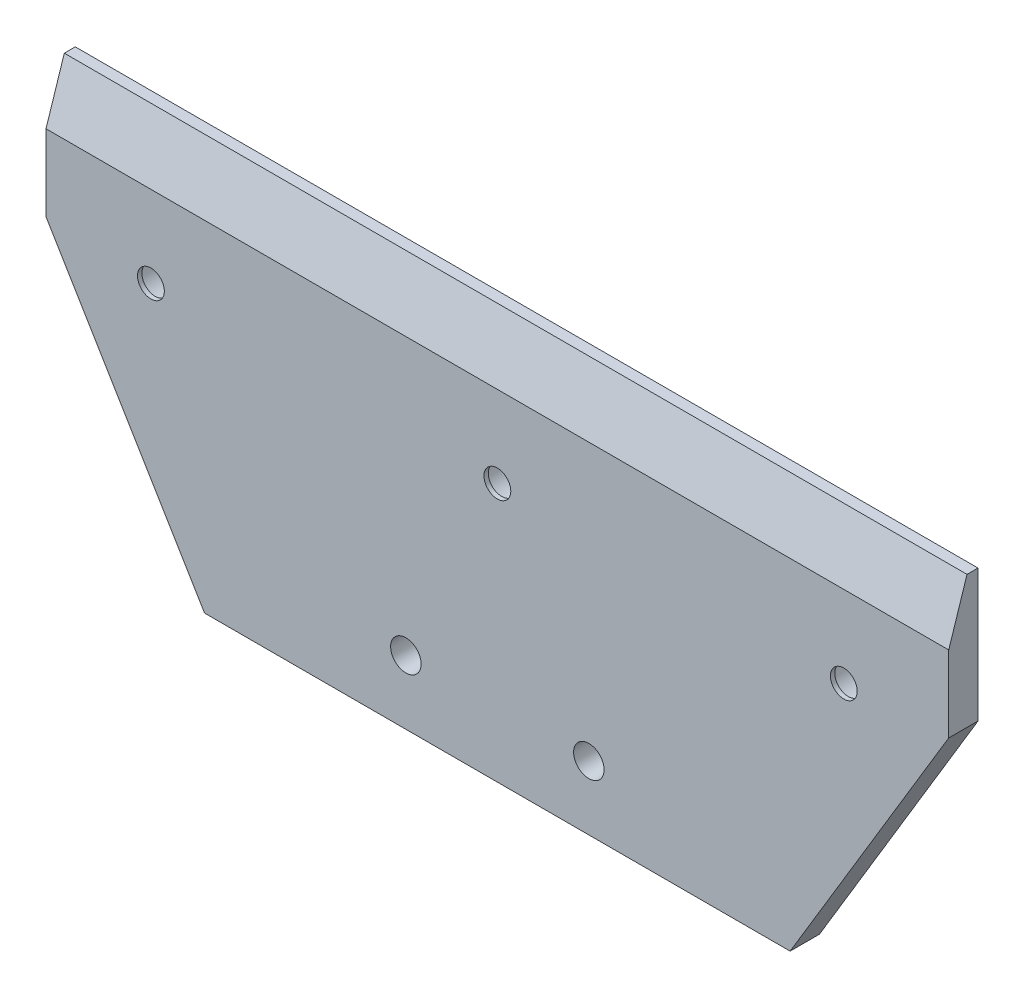
from build123d import *

# Parameters (mm, degrees)
BOSS_EXTRUDE1_DEPTH            = 1.2
CUT_EXTRUDE1_DEPTH             = 81.831243959
F_2_5_2_5_DIAMETER_HOLE1_D     = 2.5
F_2_5_2_5_DIAMETER_HOLE1_DEPTH = 10
F_2_5_2_5_DIAMETER_HOLE1_TIP   = 0.751075774
HOLEWZD1_AT_2_COUNT            = 2
HOLEWZD1_AT_2_PITCH            = 28.4
HOLEWZD1_AT_3_COUNT            = 2
HOLEWZD1_AT_3_PITCH            = 56.8


with BuildPart() as part:
    # Sketch1 → Boss-Extrude1 (new, symmetric)
    with BuildSketch(Plane.XY):
        Polygon((-24, 0), (24, 0), (37, 21.635633271), (37, 32.5), (-37, 32.5), (-37, 21.635633271), align=None)
    extrude(amount=BOSS_EXTRUDE1_DEPTH, both=True)

    # Sketch2 → Cut-Extrude1 (cut, through all)
    with BuildSketch(Plane(origin=(37, 0, 0), x_dir=(0, 0, -1), z_dir=(1, 0, 0))):
        Polygon((-1.2, 27.883474694), (0.3, 32.5), (-1.2, 32.5), align=None)
    extrude(amount=-CUT_EXTRUDE1_DEPTH, mode=Mode.SUBTRACT)

    # Ø2.5 (2.5) Diameter Hole1
    with Locations(Plane.XY.offset(1.2)):
        with Locations((-7.5, 5.25), (7.5, 5.25)):
            Hole(F_2_5_2_5_DIAMETER_HOLE1_D / 2, depth=F_2_5_2_5_DIAMETER_HOLE1_DEPTH)
            with Locations((0, 0, -(F_2_5_2_5_DIAMETER_HOLE1_DEPTH + F_2_5_2_5_DIAMETER_HOLE1_TIP / 2))):  # 118° drill point
                Cone(0, F_2_5_2_5_DIAMETER_HOLE1_D / 2, F_2_5_2_5_DIAMETER_HOLE1_TIP, mode=Mode.SUBTRACT)

    # Sketch10 → HoleWzd1 (revolve, cut)
    with BuildSketch(Plane(origin=(28.4, 21.2, -1.2), x_dir=(0, 1, 0), z_dir=(1, 0, 0))):
        Polygon((0, 0), (0, 2.4), (1.1, 2.4), (1.1, 2.040774557), (2, 1.5), (2, 0), align=None)
    holewzd1 = revolve(axis=Axis((28.4, 21.2, -7.330023899), (0, 0, 1)), mode=Mode.SUBTRACT)

    # HoleWzd1 at 2: HoleWzd1 ×2
    with Locations(*[(-i * HOLEWZD1_AT_2_PITCH, 0, 0) for i in range(1, HOLEWZD1_AT_2_COUNT)]):
        add(holewzd1, mode=Mode.SUBTRACT)

    # HoleWzd1 at 3: HoleWzd1 ×2
    with Locations(*[(-i * HOLEWZD1_AT_3_PITCH, 0, 0) for i in range(1, HOLEWZD1_AT_3_COUNT)]):
        add(holewzd1, mode=Mode.SUBTRACT)


solid = part.part
